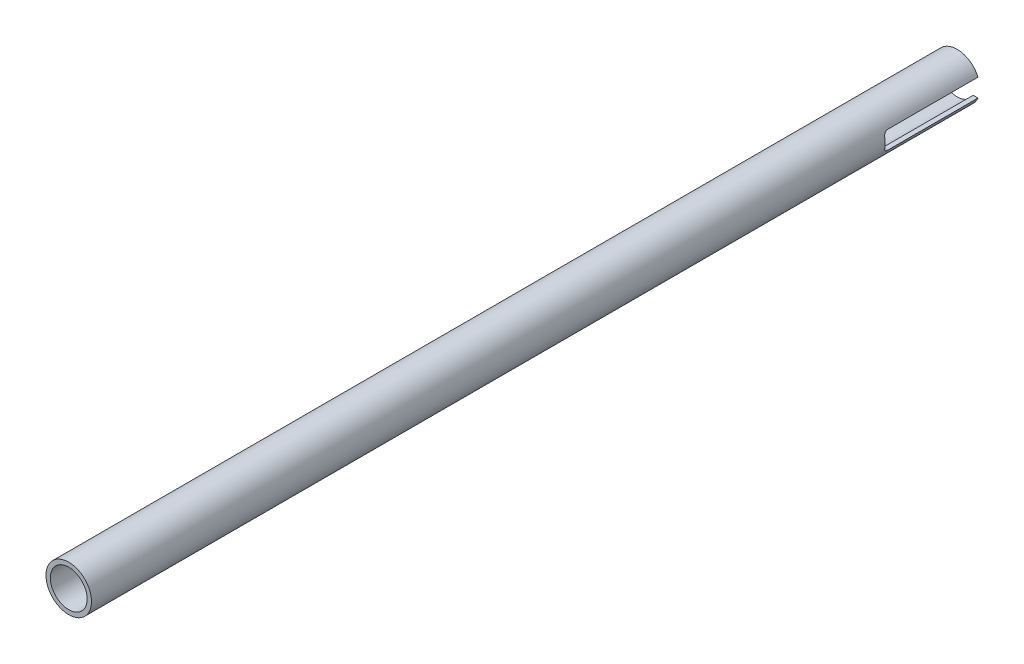
from build123d import *

# Parameters (mm, degrees)
SKETCH1_R               = 8.001
SKETCH1_R_2             = 6.477
BOSS_EXTRUDE1_DEPTH     = 312.42
CUT_EXTRUDE2_DEPTH      = 313.624836509
CUT_EXTRUDE2_DEPTH_BACK = 313.624836509


with BuildPart() as part:
    # Sketch1 → Boss-Extrude1 (new body)
    with BuildSketch(Plane.XY):
        Circle(SKETCH1_R)
        Circle(SKETCH1_R_2, mode=Mode.SUBTRACT)
    extrude(amount=BOSS_EXTRUDE1_DEPTH)

    # Sketch2 → Cut-Extrude2 (cut, two sides: drawn at the far end of the back side and taken through both)
    with BuildSketch(Plane(origin=(0, 0, 0), x_dir=(0, 0, -1), z_dir=(1, 0, 0)).offset(-CUT_EXTRUDE2_DEPTH_BACK)):
        with BuildLine():
            Line((635.239664052, 3.175), (0, 3.175))
            Line((0, 3.175), (-31.75, 3.175))
            ThreePointArc((-31.75, 3.175), (-32.827630735, 2.728630735), (-33.274, 1.651))
            Line((-33.274, 1.651), (-33.274, -1.651))
            ThreePointArc((-33.274, -1.651), (-32.827630735, -2.728630735), (-31.75, -3.175))
            Line((-31.75, -3.175), (0, -3.175))
            Line((0, -3.175), (635.239664052, -3.175))
            Line((635.239664052, -3.175), (1905.718992156, -3.175))
            Line((1905.718992156, -3.175), (1905.718992156, 3.175))
            Line((1905.718992156, 3.175), (635.239664052, 3.175))
        make_face()
    extrude(amount=CUT_EXTRUDE2_DEPTH + CUT_EXTRUDE2_DEPTH_BACK, mode=Mode.SUBTRACT)


solid = part.part
